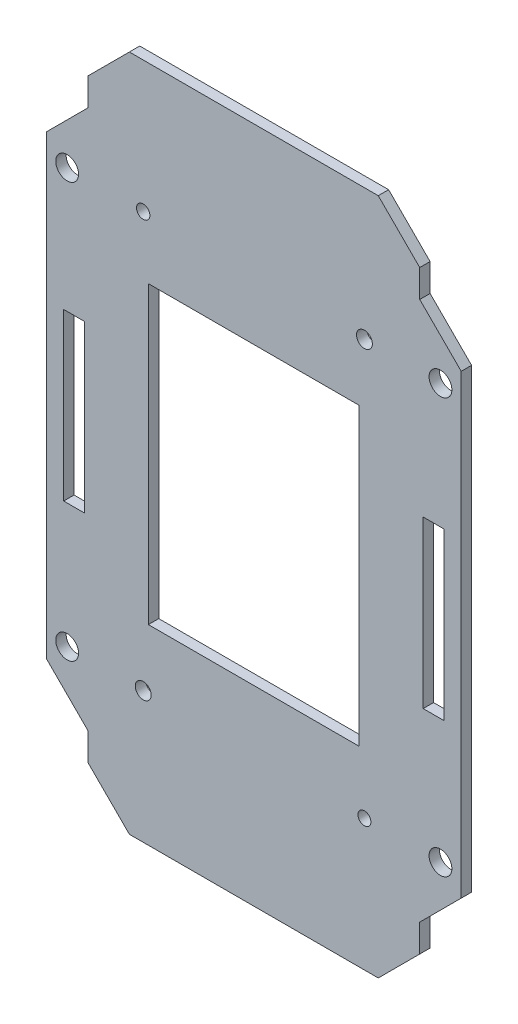
from build123d import *

# Parameters (mm, degrees)
SKETCH_1_R       = 1.15
SKETCH_1_R_2     = 0.939967297
SKETCH_1_R_3     = 0.967686678
SKETCH_1_R_4     = 1.65
SKETCH_1_W       = 30.4982
SKETCH_1_H       = 42.7098
SKETCH_1_W_2     = 3
SKETCH_1_H_2     = 24
PIXHAWK_M3_DEPTH = 1.5


with BuildPart() as part:
    # 草图1 → Pixhawk正装减振托板_绑带槽_四M3孔 (new body)
    with BuildSketch(Plane.XY):
        Polygon((24, -39), (24, -43), (18, -49), (-18, -49), (-24, -43), (-24, -39), (-30, -33), (-30, 33), (-24, 39), (-24, 43), (-18, 49), (18, 49), (24, 43), (24, 39), (30, 33), (30, -33), align=None)
        with Locations((16, 30)):
            Circle(SKETCH_1_R, mode=Mode.SUBTRACT)
        with Locations((-16, -30)):
            Circle(SKETCH_1_R, mode=Mode.SUBTRACT)
        with Locations((16, -30)):
            Circle(SKETCH_1_R_2, mode=Mode.SUBTRACT)
        with Locations((-16, 30)):
            Circle(SKETCH_1_R_3, mode=Mode.SUBTRACT)
        with Locations((-27, -30)):
            Circle(SKETCH_1_R_4, mode=Mode.SUBTRACT)
        with Locations((-27, 30)):
            Circle(SKETCH_1_R_4, mode=Mode.SUBTRACT)
        with Locations((27, -30)):
            Circle(SKETCH_1_R_4, mode=Mode.SUBTRACT)
        with Locations((27, 30)):
            Circle(SKETCH_1_R_4, mode=Mode.SUBTRACT)
        Rectangle(SKETCH_1_W, SKETCH_1_H, mode=Mode.SUBTRACT)
        with Locations((-26, 0)):
            Rectangle(SKETCH_1_W_2, SKETCH_1_H_2, mode=Mode.SUBTRACT)
        with Locations((26, 0)):
            Rectangle(SKETCH_1_W_2, SKETCH_1_H_2, mode=Mode.SUBTRACT)
    extrude(amount=PIXHAWK_M3_DEPTH)


solid = part.part
